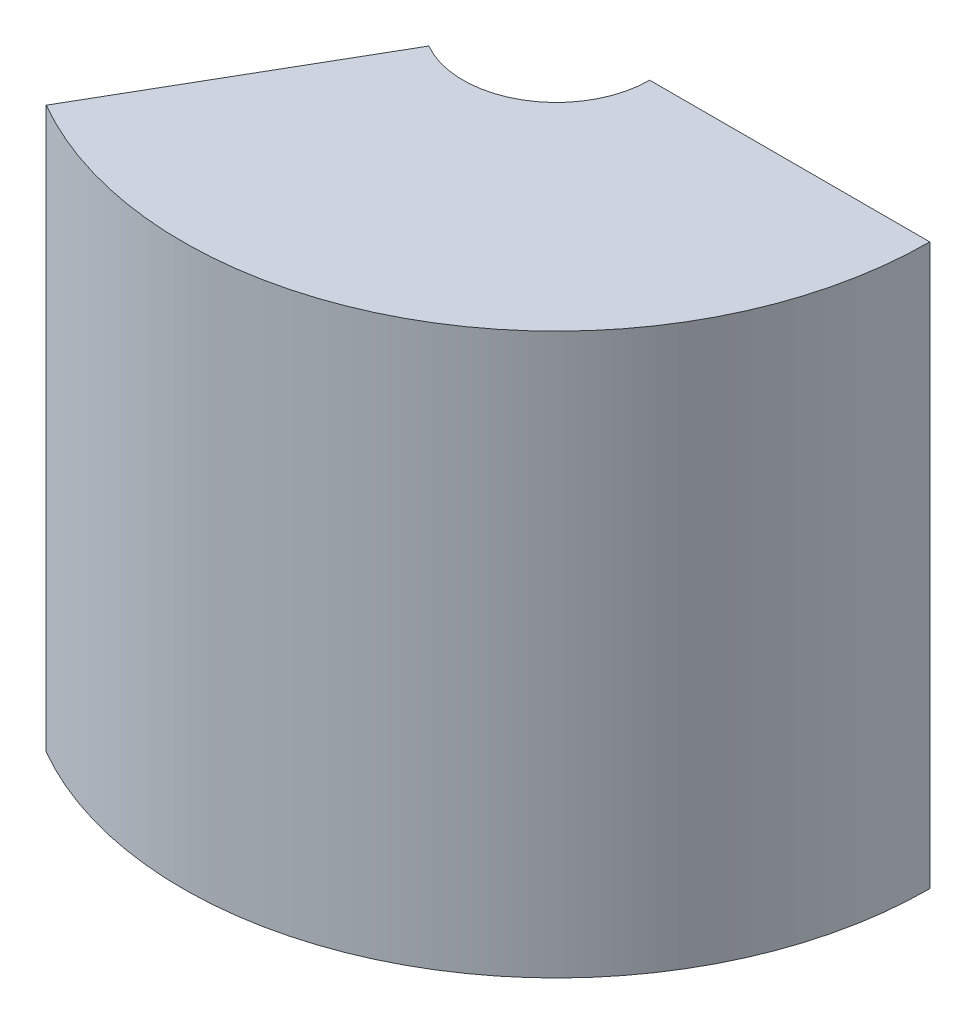
from build123d import *

# Parameters (mm, degrees)
SKETCH1_W      = 15
SKETCH1_H      = 30
REVOLVE1_ANGLE = 120


with BuildPart() as part:
    # Sketch1 → Revolve1 (revolve)
    with BuildSketch(Plane.XY):
        with Locations((12.5, 15)):
            Rectangle(SKETCH1_W, SKETCH1_H)
    revolve(axis=Axis((0, 0, 0), (0, -1, 0)), revolution_arc=REVOLVE1_ANGLE)


solid = part.part
